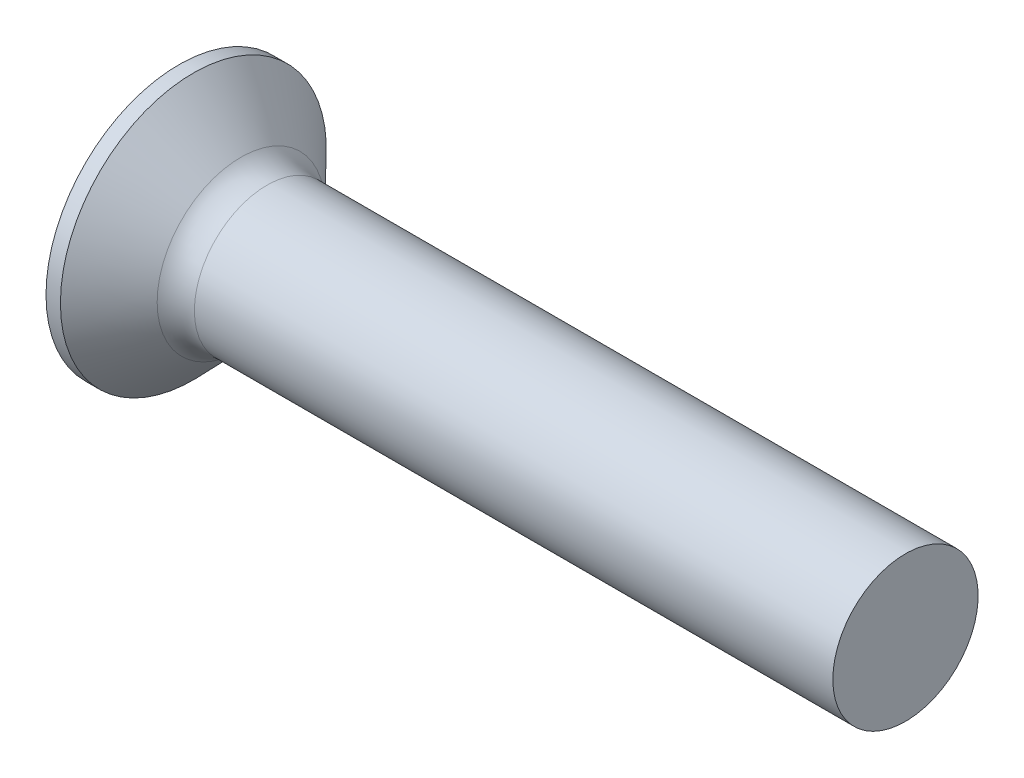
from build123d import *

# Parameters (mm, degrees)
FILLET1_R    = 2.5
RECPAT_COUNT = 2
RECPAT_ANGLE = 90


with BuildPart() as part:
    # BodySke → Base-Revolve (revolve)
    with BuildSketch(Plane.XY, mode=Mode.PRIVATE) as base_revolve_sk:
        Polygon((0, 0), (0, 9.15), (0.992391585, 9.15), (5, 5), (50, 5), (50, 0), align=None)
    revolve(base_revolve_sk.sketch.rotate(Axis((-6.35, 0, 0), (1, 0, 0)), 90), axis=Axis((-6.35, 0, 0), (1, 0, 0)))

    # Fillet1
    fillet1_edges = [part.edges().sort_by_distance(p)[0] for p in [
        (5, 0, -5),
    ]]
    fillet(fillet1_edges, radius=FILLET1_R)

    # Sketch3 → Recess section 0
    with BuildSketch(Plane.ZY):
        with BuildLine():
            Line((-1.08, 4.9), (1.08, 4.9))
            Line((1.08, 4.9), (1.08, -4.9))
            Line((1.08, -4.9), (-1.08, -4.9))
            Line((-1.08, -4.9), (-1.08, 4.9))
        make_face()
    # Sketch4 → Recess section 1
    with BuildSketch(Plane.ZY.offset(-5.64)):
        with BuildLine():
            Line((-1.08, 2.087999828), (1.08, 2.087999828))
            Line((1.08, 2.087999828), (1.08, -2.087999828))
            Line((1.08, -2.087999828), (-1.08, -2.087999828))
            Line((-1.08, -2.087999828), (-1.08, 2.087999828))
        make_face()
    recess = loft(mode=Mode.SUBTRACT)

    # RecPat: Recess ×2 about axis
    recpat_axis = Axis((0, 0, 0), (1, 0, 0))
    for i in range(1, RECPAT_COUNT):
        add(recess.rotate(recpat_axis, i * RECPAT_ANGLE / (RECPAT_COUNT - 1)), mode=Mode.SUBTRACT)

    # RecCorSke → RecessCore (revolve, cut)
    with BuildSketch(Plane.XY, mode=Mode.PRIVATE) as recesscore_sk:
        Polygon((0, 0), (0, 2.324887219), (5.64, 1.9305), (6.267257474, 0), align=None)
    revolve(recesscore_sk.sketch.rotate(Axis((-3.175, 0, 0), (1, 0, 0)), 90), axis=Axis((-3.175, 0, 0), (1, 0, 0)), mode=Mode.SUBTRACT)


solid = part.part
